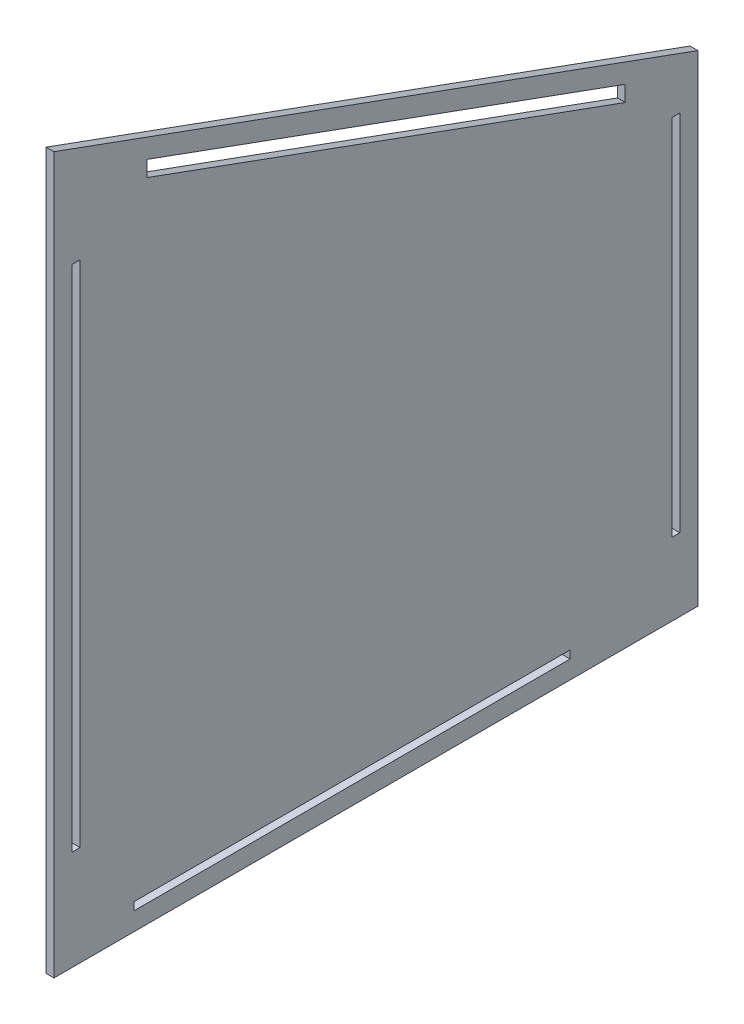
from build123d import *

# Parameters (mm, degrees)
CROQUIS1_W              = 304.8
CROQUIS1_H              = 5.5
CROQUIS1_W_2            = 5.5
CROQUIS1_H_2            = 355.6
CROQUIS1_H_3            = 254
SALIENTE_EXTRUIR1_DEPTH = 2.75


with BuildPart() as part:
    # Croquis1 → Saliente-Extruir1 (new, symmetric)
    with BuildSketch(Plane(origin=(0, 0, 0), x_dir=(0, 0, -1), z_dir=(1, 0, 0))):
        Polygon((450, 0), (0, 0), (0, 500), (450, 336.21339458), align=None)
        Polygon((65.045304049, 462.810387737), (399.2, 341.18802477), (399.2, 330.18802477), (65.045304049, 451.810387737), align=None, mode=Mode.SUBTRACT)
        with Locations((208.28, 15.45)):
            Rectangle(CROQUIS1_W, CROQUIS1_H, mode=Mode.SUBTRACT)
        with Locations((15.45, 247.65)):
            Rectangle(CROQUIS1_W_2, CROQUIS1_H_2, mode=Mode.SUBTRACT)
        with Locations((434.55, 177.8)):
            Rectangle(CROQUIS1_W_2, CROQUIS1_H_3, mode=Mode.SUBTRACT)
    extrude(amount=SALIENTE_EXTRUIR1_DEPTH, both=True)


solid = part.part
